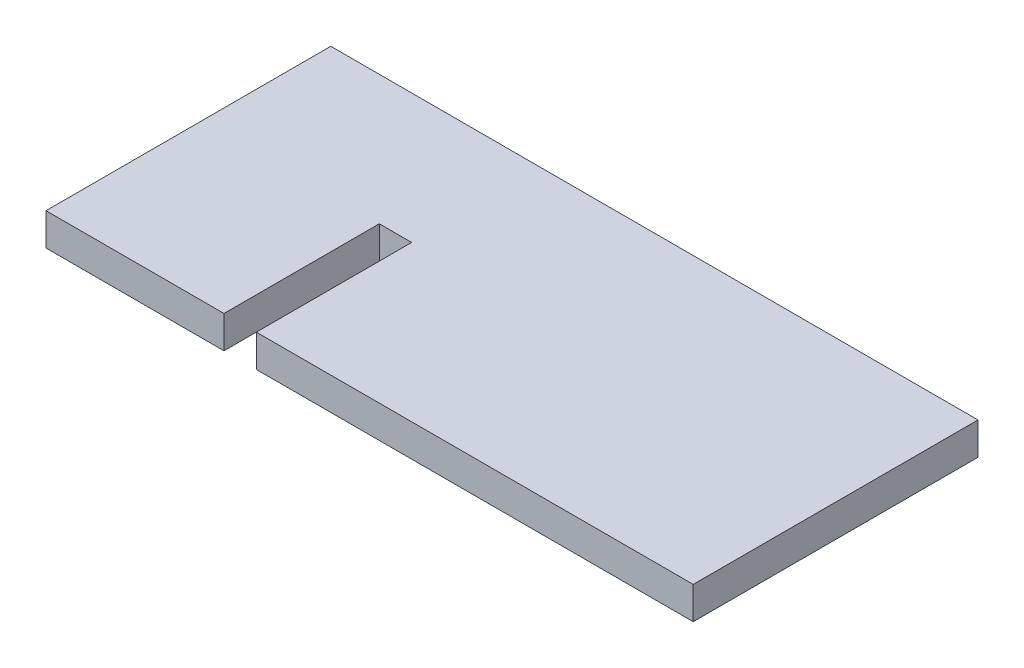
from build123d import *

# Parameters (mm, degrees)
SKETCH2_W           = 63.5
SKETCH2_H           = 27.94
BOSS_EXTRUDE1_DEPTH = 3.175
SKETCH3_W           = 3.175
SKETCH3_H           = 15.24
CUT_EXTRUDE1_DEPTH  = 70.447636569


with BuildPart() as part:
    # Sketch2 → Boss-Extrude1 (new body)
    with BuildSketch(Plane(origin=(0, 0, 0), x_dir=(1, 0, 0), z_dir=(0, 1, 0))):
        with Locations((31.75, 13.97)):
            Rectangle(SKETCH2_W, SKETCH2_H)
    extrude(amount=BOSS_EXTRUDE1_DEPTH)

    # Sketch3 → Cut-Extrude1 (cut, through all)
    with BuildSketch(Plane.XZ):
        with Locations((19.05, -7.62)):
            Rectangle(SKETCH3_W, SKETCH3_H)
    extrude(amount=-CUT_EXTRUDE1_DEPTH, mode=Mode.SUBTRACT)


solid = part.part
